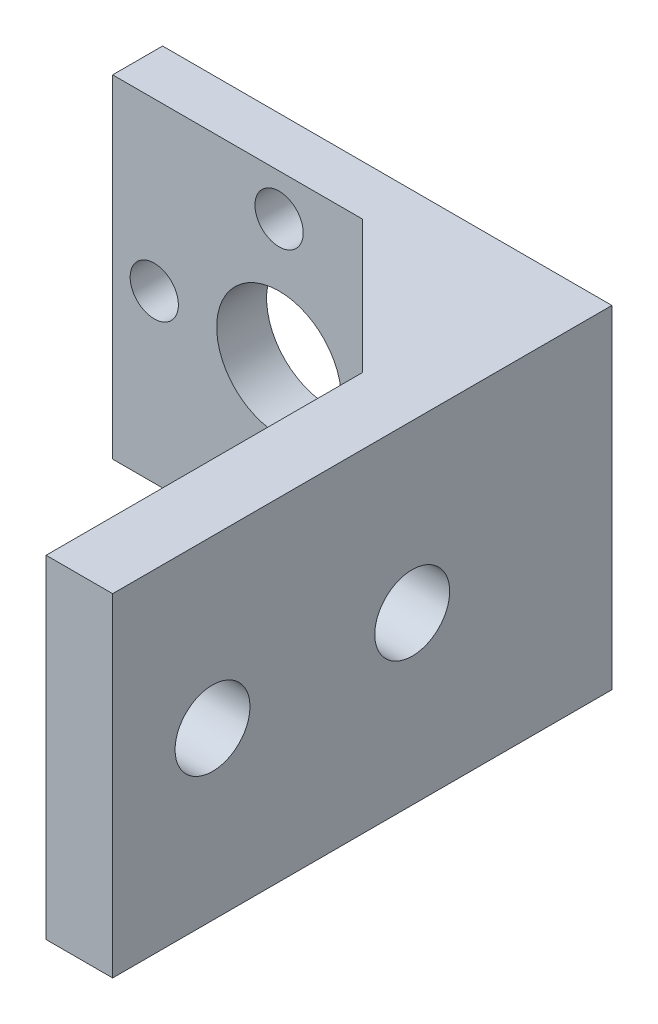
from build123d import *

# Parameters (mm, degrees)
SKETCH_1_W                   = 20
SKETCH_1_H                   = 20
EXTRUDE_1_DEPTH              = 3
SKETCH_8_W                   = 3
SKETCH_8_H                   = 20
EXTRUDE_3_DEPTH              = 3
SKETCH_2_R                   = 3.75
CUT_EXTRUDE_1_DEPTH          = 17.673332001
SKETCH_3_W                   = 4
SKETCH_3_H                   = 20
EXTRUDE_2_DEPTH              = 30
CHAMFER_1_SIZE               = 8
SKETCH_9_R                   = 10.5
CUT_EXTRUDE_2_DEPTH          = 27
HOLE_WIZARD_M4_1_D           = 4.5
HOLE_WIZARD_M4_1_CBORE_D     = 8
HOLE_WIZARD_M4_1_CBORE_DEPTH = 23
HOLE_WIZARD_M2_5_1_D         = 2.9


with BuildPart() as part:
    # 草圖1 → 填料-伸長1 (new body)
    with BuildSketch(Plane.XY):
        Rectangle(SKETCH_1_W, SKETCH_1_H)
    extrude(amount=EXTRUDE_1_DEPTH)

    # 草圖8 → 填料-伸長3 (add)
    with BuildSketch(Plane(origin=(10, 0, 0), x_dir=(0, 0, -1), z_dir=(1, 0, 0))):
        with Locations((-1.5, 0)):
            Rectangle(SKETCH_8_W, SKETCH_8_H)
    extrude(amount=EXTRUDE_3_DEPTH)

    # 草圖2 → 除料-伸長1 (cut, through all)
    with BuildSketch(Plane.XY.offset(3)):
        Circle(SKETCH_2_R)
    extrude(amount=-CUT_EXTRUDE_1_DEPTH, mode=Mode.SUBTRACT)

    # 草圖3 → 填料-伸長2 (add)
    with BuildSketch(Plane(origin=(0, 0, 0), x_dir=(-1, 0, 0), z_dir=(0, 0, -1))):
        with Locations((-15, 0)):
            Rectangle(SKETCH_3_W, SKETCH_3_H)
    extrude(amount=-EXTRUDE_2_DEPTH)

    # 導角1
    chamfer_1_edges = [part.edges().sort_by_distance(p)[0] for p in [
        (13, 0, 3),
    ]]
    chamfer(chamfer_1_edges, length=CHAMFER_1_SIZE)

    # 草圖9 → 除料-伸長2 (cut)
    with BuildSketch(Plane.XY.offset(30)):
        Circle(SKETCH_9_R)
    extrude(amount=-CUT_EXTRUDE_2_DEPTH, mode=Mode.SUBTRACT)

    # M4 凹頭蓋螺釘的柱孔1 (through all)
    with Locations(Plane.ZY.offset(10)):
        with Locations((24, 0), (12, 0)):
            CounterBoreHole(HOLE_WIZARD_M4_1_D / 2, HOLE_WIZARD_M4_1_CBORE_D / 2, HOLE_WIZARD_M4_1_CBORE_DEPTH)

    # M2.5 餘隙孔1 (through all)
    with Locations(Plane(origin=(0, 0, 0), x_dir=(-1, 0, 0), z_dir=(0, 0, -1))):
        with Locations((0, -7.5), (0, 7.5), (-7.5, 0), (7.5, 0)):
            Hole(HOLE_WIZARD_M2_5_1_D / 2)


solid = part.part
